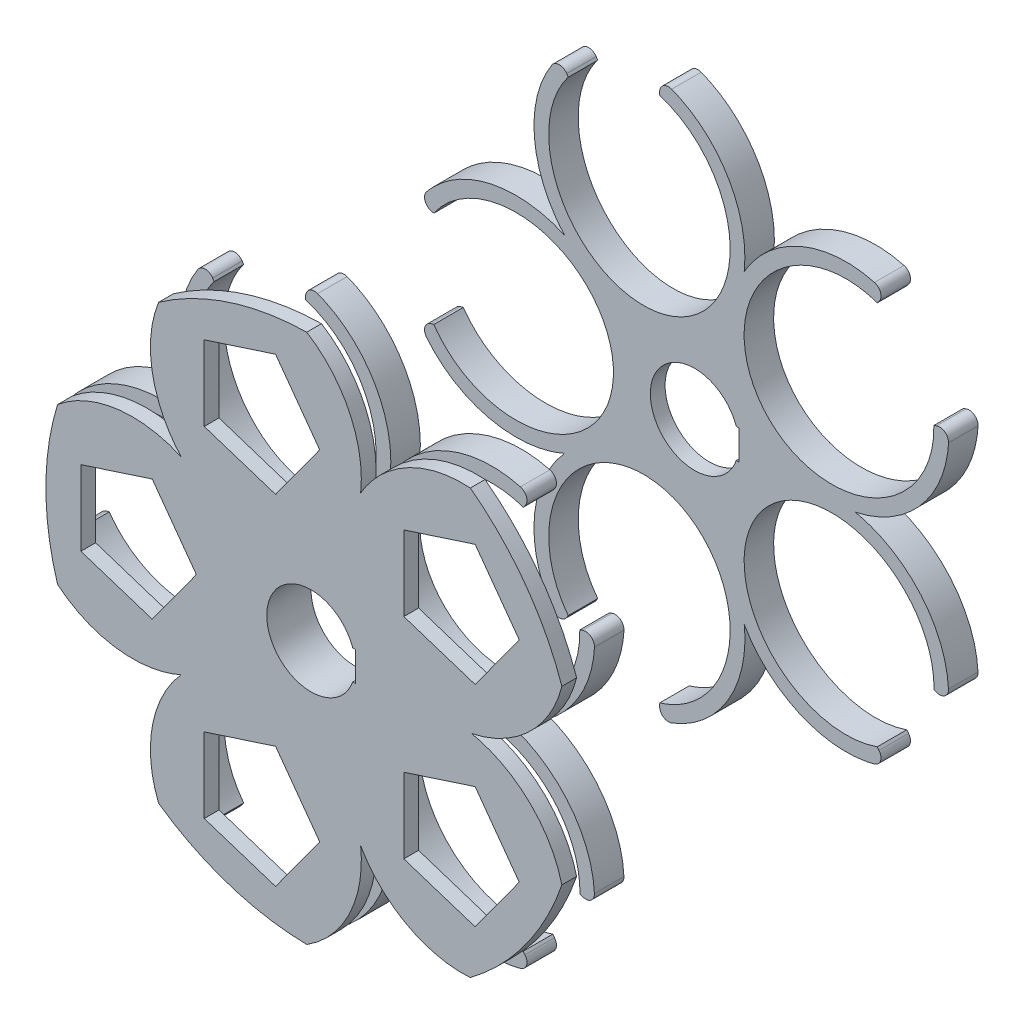
from build123d import *

# Parameters (mm, degrees)
BOSS_EXTRUDE1_DEPTH = 10
CIRPATTERN1_COUNT   = 5
SKETCH4_R           = 15
BOSS_EXTRUDE2_DEPTH = 5
LPATTERN1_COUNT     = 2
LPATTERN1_PITCH     = 120
BOSS_EXTRUDE3_START = 5
SKETCH5_R           = 15
BOSS_EXTRUDE3_DEPTH = 5
BOSS_EXTRUDE4_START = 5
SKETCH6_R           = 15
BOSS_EXTRUDE4_DEPTH = 5
SKETCH7_W           = 0.857864376
SKETCH7_H           = 10
CUT_EXTRUDE1_DEPTH  = 192.484118593


with BuildPart() as part:
    # Sketch1 → Boss-Extrude1 (new body)
    with BuildSketch(Plane.XY):
        with BuildLine():
            Line((-88.382850735, 16.313510687), (-89.307254436, 16.561203912))
            ThreePointArc((-89.307254436, 16.561203912), (-91.382679119, 18.527976509), (-90.867460042, 21.340472085))
            add(Edge.make_bspline(
                [(-90.867460042, -21.340472085), (-22.5, -106.247454149), (-22.5, 0), (-22.5, 106.247454149), (-90.867460042, 21.340472085)],
                knots=[0.644926945, 0.644926945, 0.644926945, 3.141592654, 3.141592654, 5.638258362, 5.638258362, 5.638258362], degree=2, weights=[1, 0.316904019, 1, 0.316904019, 1]))
            ThreePointArc((-90.867460042, -21.340472085), (-91.382679119, -18.527976509), (-89.307254436, -16.561203912))
            Line((-89.307254436, -16.561203912), (-88.382850735, -16.313510687))
            add(Edge.make_bspline(
                [(-88.382850735, -16.313510687), (-27.5, -105.204250416), (-27.5, 0), (-27.5, 105.204250416), (-88.382850735, 16.313510687)],
                knots=[3.705945592, 3.705945592, 3.705945592, 6.283185307, 6.283185307, 8.860425023, 8.860425023, 8.860425023], degree=2, weights=[1, 0.2784467, 1, 0.2784467, 1]))
        make_face()
    extrude(amount=BOSS_EXTRUDE1_DEPTH)


with BuildPart() as cirpattern1_1:
    # CirPattern1: pattern copy
    add(part.part.rotate(Axis((0, 0, 0), (0, 0, 1)), 1 * 360 / CIRPATTERN1_COUNT))


with BuildPart() as cirpattern1_2:
    # CirPattern1: pattern copy
    add(part.part.rotate(Axis((0, 0, 0), (0, 0, 1)), 2 * 360 / CIRPATTERN1_COUNT))


with BuildPart() as cirpattern1_3:
    # CirPattern1: pattern copy
    add(part.part.rotate(Axis((0, 0, 0), (0, 0, 1)), 3 * 360 / CIRPATTERN1_COUNT))


with BuildPart() as cirpattern1_4:
    # CirPattern1: pattern copy
    add(part.part.rotate(Axis((0, 0, 0), (0, 0, 1)), 4 * 360 / CIRPATTERN1_COUNT))


with BuildPart() as part_1:
    add(part.part)

    add(cirpattern1_1.part)  # Boss-Extrude2 merges CirPattern1_1

    add(cirpattern1_2.part)  # Boss-Extrude2 merges CirPattern1_2

    add(cirpattern1_3.part)  # Boss-Extrude2 merges CirPattern1_3

    add(cirpattern1_4.part)  # Boss-Extrude2 merges CirPattern1_4
    # Sketch4 → Boss-Extrude2 (add)
    with BuildSketch(Plane.XY.offset(10)):
        with BuildLine():
            add(Edge.make_bspline(
                [(11.977672972, -36.863486919), (-3.383612367, -10.41368808), (-31.357954946, -22.78288786)],
                knots=[5.586379321, 5.586379321, 5.586379321, 6.979991294, 6.979991294, 6.979991294], degree=2, weights=[1, 0.766895922, 1]))
            add(Edge.make_bspline(
                [(38.760563949, 0), (8.858412183, -6.436013181), (11.977672972, -36.863486919)],
                knots=[2.444786667, 2.444786667, 2.444786667, 3.83839864, 3.83839864, 3.83839864], degree=2, weights=[1, 0.766895922, 1]))
            add(Edge.make_bspline(
                [(11.977672972, 36.863486919), (8.858412183, 6.436013181), (38.760563949, 0)],
                knots=[5.586379321, 5.586379321, 5.586379321, 6.979991294, 6.979991294, 6.979991294], degree=2, weights=[1, 0.766895922, 1]))
            add(Edge.make_bspline(
                [(-31.357954946, 22.78288786), (-3.383612367, 10.41368808), (11.977672972, 36.863486919)],
                knots=[2.444786667, 2.444786667, 2.444786667, 3.83839864, 3.83839864, 3.83839864], degree=2, weights=[1, 0.766895922, 1]))
            add(Edge.make_bspline(
                [(-31.357954946, -22.78288786), (-10.949599631, 0), (-31.357954946, 22.78288786)],
                knots=[2.444786667, 2.444786667, 2.444786667, 3.83839864, 3.83839864, 3.83839864], degree=2, weights=[1, 0.766895922, 1]))
        make_face()
        Circle(SKETCH4_R, mode=Mode.SUBTRACT)
    extrude(amount=-BOSS_EXTRUDE2_DEPTH)


with BuildPart() as lpattern1_1:
    # LPattern1: pattern copy
    add(part_1.part.moved(Location(Vector(0, 0, 1) * (1 * LPATTERN1_PITCH))))

    # Sketch5 → Boss-Extrude3 (add)
    with BuildSketch(Plane.XY.offset(130).offset(BOSS_EXTRUDE3_START)):
        Polygon((9.549150281, 29.389262615), (-25, 18.1635632), (-25, -18.1635632), (9.549150281, -29.389262615), (30.901699437, 0), align=None)
        Circle(SKETCH5_R, mode=Mode.SUBTRACT)
    extrude(amount=-BOSS_EXTRUDE3_DEPTH)

    # Sketch6 → Boss-Extrude4 (add)
    with BuildSketch(Plane.XY.offset(135).offset(BOSS_EXTRUDE4_START)):
        with BuildLine():
            ThreePointArc((-51.650155218, -73.55216109), (-27.77314874, -85.476962651), (-1.447022229, -89.86414781))
            add(Edge.make_bspline(
                [(-1.447022229, -89.86414781), (19.528995157, -76.777970685), (16.821587807, -51.771523862)],
                knots=[3.979843697, 3.979843697, 3.979843697, 5.160397391, 5.160397391, 5.160397391], degree=2, weights=[1, 0.83078662, 1]))
            add(Edge.make_bspline(
                [(16.821587807, -51.771523862), (29.329669904, -73.593538423), (53.991486367, -71.851084438)],
                knots=[1.122787916, 1.122787916, 1.122787916, 2.30334161, 2.30334161, 2.30334161], degree=2, weights=[1, 0.83078662, 1]))
            ThreePointArc((53.991486367, -71.851084438), (72.711047375, -52.827668174), (85.018728896, -29.145748779))
            add(Edge.make_bspline(
                [(85.018728896, -29.145748779), (79.054980714, -5.152519634), (54.435801632, 0)],
                knots=[3.979843697, 3.979843697, 3.979843697, 5.160397391, 5.160397391, 5.160397391], degree=2, weights=[1, 0.83078662, 1]))
            add(Edge.make_bspline(
                [(54.435801632, 0), (79.054980714, 5.152519634), (85.018728896, 29.145748779)],
                knots=[1.122787916, 1.122787916, 1.122787916, 2.30334161, 2.30334161, 2.30334161], degree=2, weights=[1, 0.83078662, 1]))
            ThreePointArc((85.018728896, 29.145748779), (72.711047375, 52.827668174), (53.991486367, 71.851084438))
            add(Edge.make_bspline(
                [(53.991486367, 71.851084438), (29.329669904, 73.593538423), (16.821587807, 51.771523862)],
                knots=[3.979843697, 3.979843697, 3.979843697, 5.160397391, 5.160397391, 5.160397391], degree=2, weights=[1, 0.83078662, 1]))
            add(Edge.make_bspline(
                [(16.821587807, 51.771523862), (19.528995157, 76.777970685), (-1.447022229, 89.86414781)],
                knots=[1.122787916, 1.122787916, 1.122787916, 2.30334161, 2.30334161, 2.30334161], degree=2, weights=[1, 0.83078662, 1]))
            ThreePointArc((-1.447022229, 89.86414781), (-27.77314874, 85.476962651), (-51.650155218, 73.55216109))
            add(Edge.make_bspline(
                [(-51.650155218, 73.55216109), (-60.928247835, 50.635827732), (-44.039488622, 31.996561396)],
                knots=[3.979843697, 3.979843697, 3.979843697, 5.160397391, 5.160397391, 5.160397391], degree=2, weights=[1, 0.83078662, 1]))
            add(Edge.make_bspline(
                [(-44.039488622, 31.996561396), (-66.985397941, 42.298875836), (-85.913037816, 26.393348938)],
                knots=[4.264380569, 4.264380569, 4.264380569, 5.444934264, 5.444934264, 5.444934264], degree=2, weights=[1, 0.83078662, 1]))
            ThreePointArc((-85.913037816, 26.393348938), (-89.875797271, 0), (-85.913037816, -26.393348938))
            add(Edge.make_bspline(
                [(-85.913037816, -26.393348938), (-66.985397941, -42.298875836), (-44.039488622, -31.996561396)],
                knots=[0.838251043, 0.838251043, 0.838251043, 2.018804738, 2.018804738, 2.018804738], degree=2, weights=[1, 0.83078662, 1]))
            add(Edge.make_bspline(
                [(-44.039488622, -31.996561396), (-60.928247835, -50.635827732), (-51.650155218, -73.55216109)],
                knots=[1.122787916, 1.122787916, 1.122787916, 2.30334161, 2.30334161, 2.30334161], degree=2, weights=[1, 0.83078662, 1]))
        make_face()
        Circle(SKETCH6_R, mode=Mode.SUBTRACT)
        Polygon((2.935661447, 57.538919236), (-12.011122963, 78.111403066), (-36.19552816, 70.253413476), (-36.19552816, 44.824424996), (-12.011122963, 36.966435406), align=None, mode=Mode.SUBTRACT)
        Polygon((-38.868810394, 0), (-53.815594803, 20.57248383), (-78, 12.71449424), (-78, -12.71449424), (-53.815594803, -20.57248383), align=None, mode=Mode.SUBTRACT)
        Polygon((55.629933357, 14.988523933), (70.576717766, 35.561007764), (55.629933357, 56.133491594), (31.44552816, 48.275502004), (31.44552816, 22.846513524), align=None, mode=Mode.SUBTRACT)
        Polygon((31.44552816, -48.275502004), (55.629933357, -56.133491594), (70.576717766, -35.561007764), (55.629933357, -14.988523933), (31.44552816, -22.846513524), align=None, mode=Mode.SUBTRACT)
        Polygon((-36.19552816, -44.824424996), (-36.19552816, -70.253413476), (-12.011122963, -78.111403066), (2.935661447, -57.538919236), (-12.011122963, -36.966435406), align=None, mode=Mode.SUBTRACT)
    extrude(amount=-BOSS_EXTRUDE4_DEPTH)


with BuildPart() as cut_extrude1_tool:
    # Sketch7 → Cut-Extrude1 (new, through all)
    with BuildSketch(Plane.XY.offset(140)):
        with Locations((14.571067812, 0)):
            Rectangle(SKETCH7_W, SKETCH7_H)
    extrude(amount=-CUT_EXTRUDE1_DEPTH)


with BuildPart() as part_2:
    add(part_1.part)

    # Cut-Extrude1: cut by cut_extrude1_tool
    add(cut_extrude1_tool.part, mode=Mode.SUBTRACT)


with BuildPart() as lpattern1_1_1:
    add(lpattern1_1.part)

    # Cut-Extrude1: cut by cut_extrude1_tool
    add(cut_extrude1_tool.part, mode=Mode.SUBTRACT)


solid = Compound([part_2.part, lpattern1_1_1.part])
